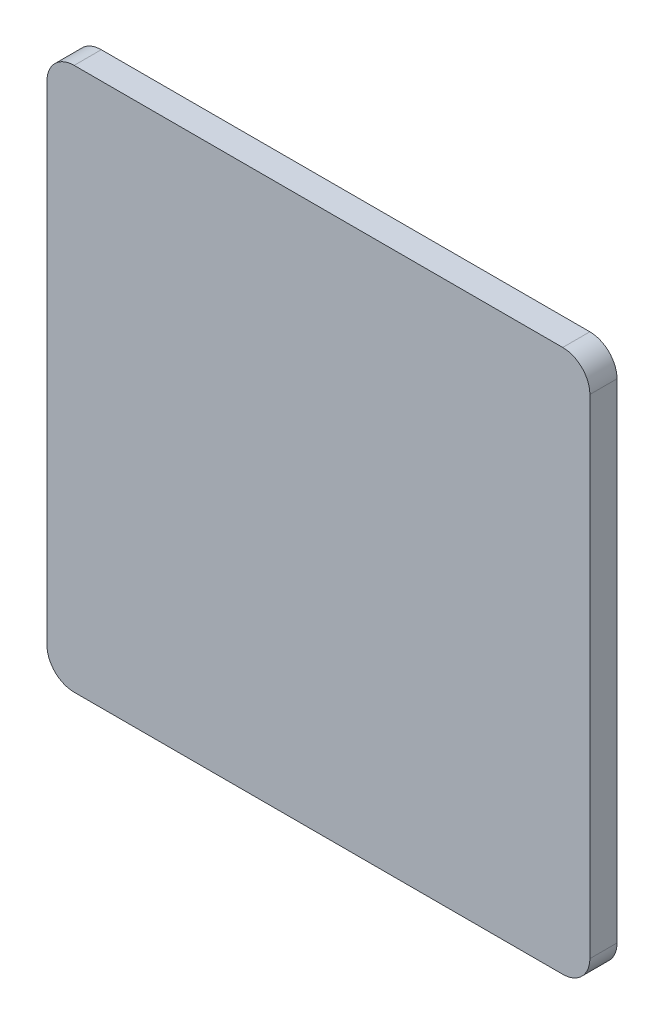
from build123d import *

# Parameters (mm, degrees)
SKETCH1_W           = 20
SKETCH1_H           = 20
BOSS_EXTRUDE1_DEPTH = 1
FILLET1_R           = 1


with BuildPart() as part:
    # Sketch1 → Boss-Extrude1 (new body)
    with BuildSketch(Plane.XY):
        with Locations((10, 10)):
            Rectangle(SKETCH1_W, SKETCH1_H)
    extrude(amount=BOSS_EXTRUDE1_DEPTH)

    # Fillet1
    fillet1_edges = [part.edges().sort_by_distance(p)[0] for p in [
        (0, 20, 0.5),
        (20, 20, 0.5),
        (20, 0, 0.5),
        (0, 0, 0.5),
    ]]
    fillet(fillet1_edges, radius=FILLET1_R)


solid = part.part
